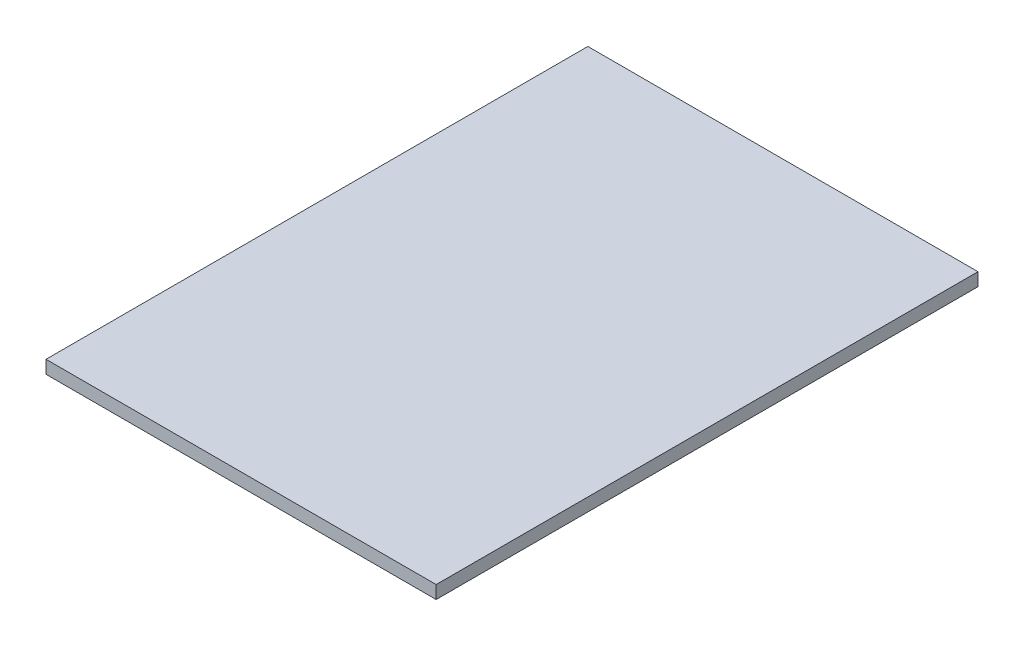
from build123d import *

# Parameters (mm, degrees)
SKETCH1_W           = 180
SKETCH1_H           = 250
BOSS_EXTRUDE1_DEPTH = 6


with BuildPart() as part:
    # Sketch1 → Boss-Extrude1 (new body)
    with BuildSketch(Plane(origin=(0, 0, 0), x_dir=(1, 0, 0), z_dir=(0, 1, 0))):
        Rectangle(SKETCH1_W, SKETCH1_H)
    extrude(amount=BOSS_EXTRUDE1_DEPTH)


solid = part.part
